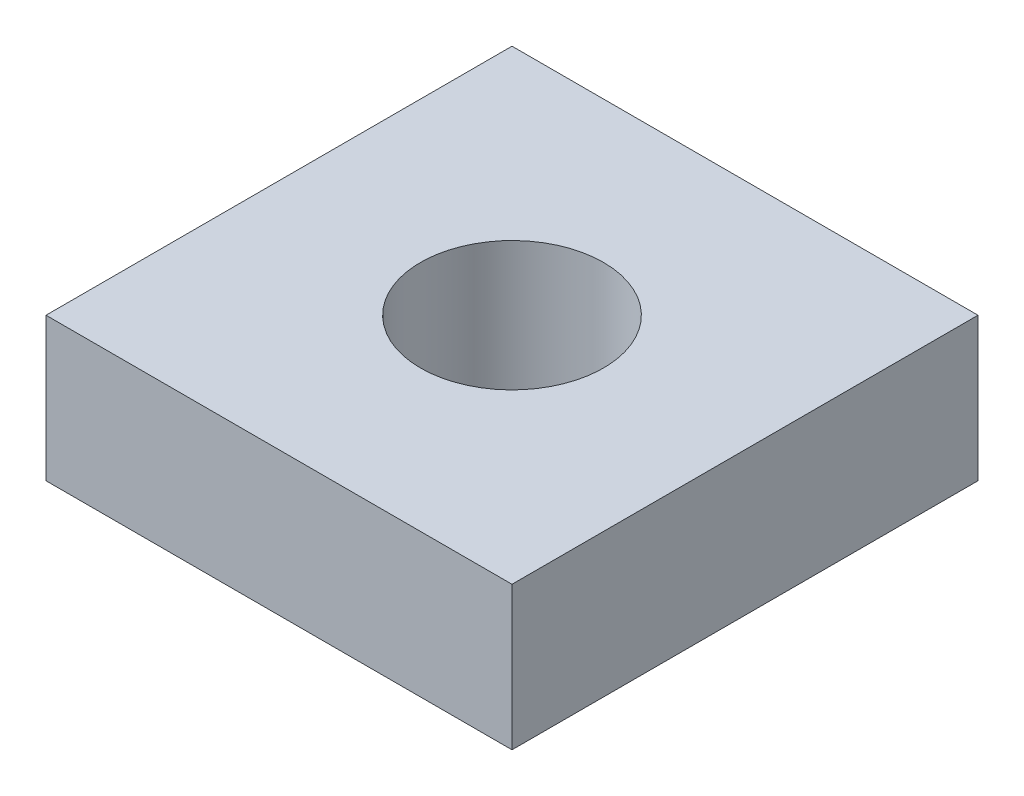
from build123d import *

# Parameters (mm, degrees)
SKIZZE1_W                       = 13
SKIZZE1_H                       = 4
AUFSATZ_LINEAR_AUSTRAGEN1_DEPTH = 13
F_1_4_20_GEWINDEBOHRUNG2_D      = 5.1054


with BuildPart() as part:
    # Skizze1 → Aufsatz-Linear austragen1 (new body)
    with BuildSketch(Plane.XY):
        with Locations((6.5, 2)):
            Rectangle(SKIZZE1_W, SKIZZE1_H)
    extrude(amount=AUFSATZ_LINEAR_AUSTRAGEN1_DEPTH)

    # 1/4-20 Gewindebohrung2 (through all)
    with Locations(Plane(origin=(0, 4, 0), x_dir=(1, 0, 0), z_dir=(0, 1, 0))):
        with Locations((6.5, -6.5)):
            Hole(F_1_4_20_GEWINDEBOHRUNG2_D / 2)


solid = part.part
